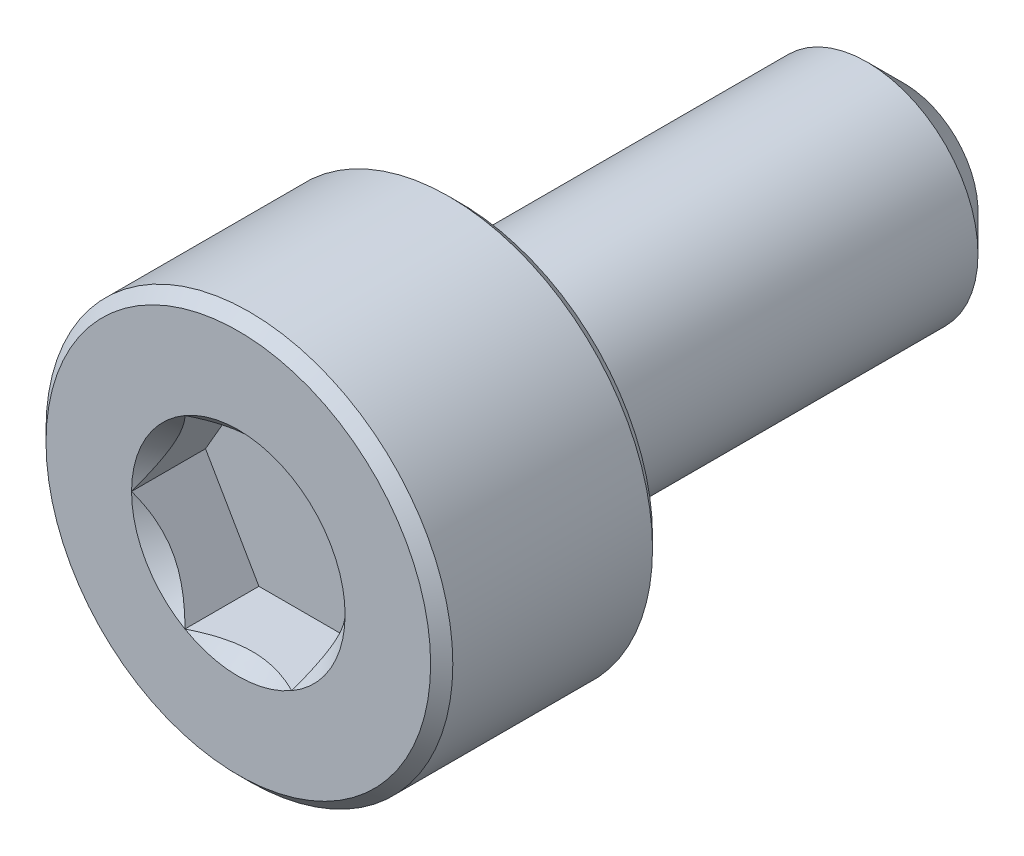
from build123d import *

# Parameters (mm, degrees)
CUT_EXTRUDE1_DEPTH = 1
SKETCH4_R          = 1.443375673
CUT_EXTRUDE2_DEPTH = 0.5
CUT_EXTRUDE2_DRAFT = -45


with BuildPart() as part:
    # Sketch2 → Revolve1 (revolve)
    with BuildSketch(Plane(origin=(0, 0, 0), x_dir=(0, 0, -1), z_dir=(1, 0, 0)), mode=Mode.PRIVATE) as revolve1_sk:
        Polygon((-4.35, 2.75), (-1.65, 2.75), (-1.5, 2.6), (-1.5, 1.5), (4, 1.5), (4.5, 1), (4.5, 0), (-4.5, 0), (-4.5, 2.6), align=None)
    revolve(revolve1_sk.sketch.rotate(Axis((0, 0, -4.5), (0, 0, 1)), 90), axis=Axis((0, 0, -4.5), (0, 0, 1)))

    # Sketch3 → Cut-Extrude1 (cut)
    with BuildSketch(Plane.XY.offset(4.5)):
        Polygon((0.721687836, 1.25), (-0.721687836, 1.25), (-1.443375673, 0), (-0.721687836, -1.25), (0.721687836, -1.25), (1.443375673, 0), align=None)
    extrude(amount=-CUT_EXTRUDE1_DEPTH, mode=Mode.SUBTRACT)


with BuildPart() as cut_extrude2_tool:
    # Sketch4 → Cut-Extrude2 (with draft: the straight prism first)
    with BuildSketch(Plane.XY.offset(4.5)):
        Circle(SKETCH4_R)
    extrude(amount=-CUT_EXTRUDE2_DEPTH)
    # Cut-Extrude2: the draft: its side faces are tilted about the plane it starts from
    cut_extrude2_sides = [cut_extrude2_tool.faces().sort_by_distance(p)[0] for p in [
        (-1.443375673, 0, 4.25),
    ]]
    draft(cut_extrude2_sides, Plane.XY.offset(4.5), CUT_EXTRUDE2_DRAFT)


with BuildPart() as part_1:
    add(part.part)

    # Cut-Extrude2: cut by cut_extrude2_tool
    add(cut_extrude2_tool.part, mode=Mode.SUBTRACT)


solid = part_1.part
